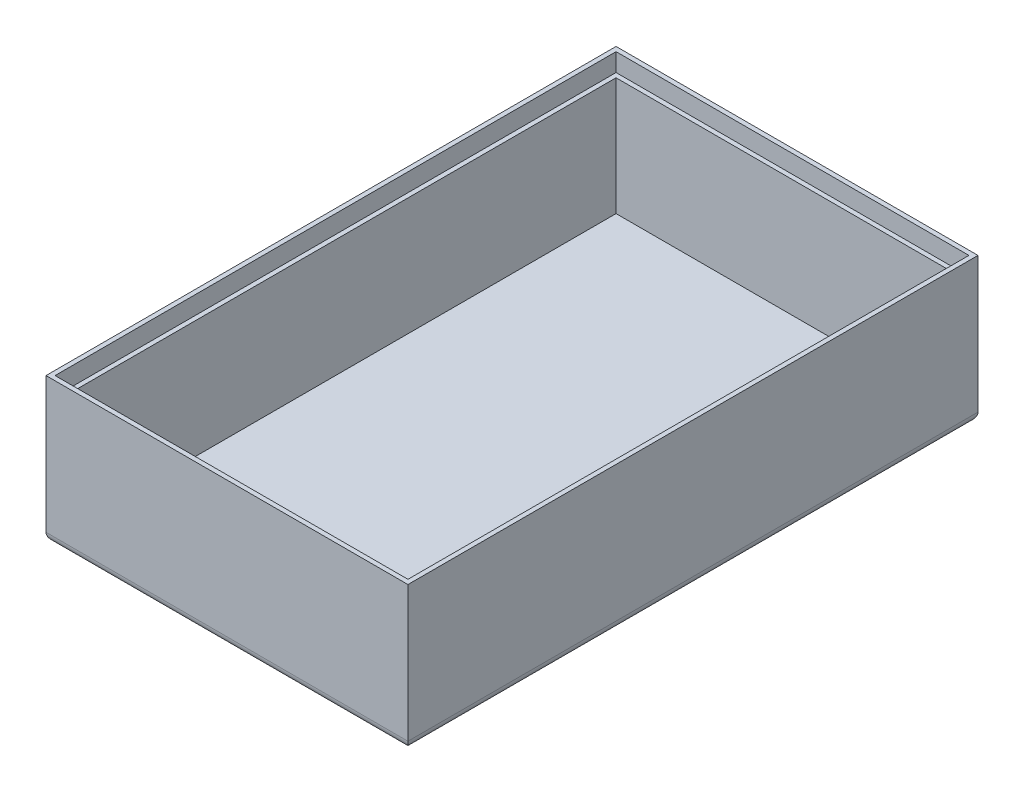
from build123d import *

# Parameters (mm, degrees)
SKETCH_1_W          = 40
SKETCH_1_H          = 63
EXTRUDE_1_DEPTH     = 16
SKETCH_2_W          = 38
SKETCH_2_H          = 61
CUT_EXTRUDE_2_DEPTH = 15
FILLET_2_R          = 1
SKETCH_5_W          = 38
SKETCH_5_H          = 2
CUT_EXTRUDE_4_DEPTH = 0.5
SKETCH_6_W          = 61.5
SKETCH_6_H          = 2
CUT_EXTRUDE_5_DEPTH = 0.5
SKETCH_7_W          = 38.5
SKETCH_7_H          = 2
CUT_EXTRUDE_6_DEPTH = 0.5
SKETCH_8_W          = 62
SKETCH_8_H          = 2
CUT_EXTRUDE_7_DEPTH = 0.5


with BuildPart() as part:
    # Эскиз1 → Бобышка-Вытянуть1 (new body)
    with BuildSketch(Plane(origin=(0, 0, 0), x_dir=(1, 0, 0), z_dir=(0, 1, 0))):
        with Locations((18.915, -30.961)):
            Rectangle(SKETCH_1_W, SKETCH_1_H)
    extrude(amount=EXTRUDE_1_DEPTH)

    # Эскиз2 → Вырез-Вытянуть2 (cut)
    with BuildSketch(Plane(origin=(0, 16, 0), x_dir=(1, 0, 0), z_dir=(0, 1, 0))):
        with Locations((18.915, -30.961)):
            Rectangle(SKETCH_2_W, SKETCH_2_H)
    extrude(amount=-CUT_EXTRUDE_2_DEPTH, mode=Mode.SUBTRACT)

    # Скругление2
    fillet_2_edges = [part.edges().sort_by_distance(p)[0] for p in [
        (18.915, 0, -0.539),
        (38.915, 0, 30.961),
        (18.915, 0, 62.461),
        (-1.085, 0, 30.961),
    ]]
    fillet(fillet_2_edges, radius=FILLET_2_R)

    # Эскиз5 → Вырез-Вытянуть4 (cut)
    with BuildSketch(Plane(origin=(0, 0, 61.461), x_dir=(-1, 0, 0), z_dir=(0, 0, -1))):
        with Locations((-18.915, 15)):
            Rectangle(SKETCH_5_W, SKETCH_5_H)
    extrude(amount=-CUT_EXTRUDE_4_DEPTH, mode=Mode.SUBTRACT)

    # Эскиз6 → Вырез-Вытянуть5 (cut)
    with BuildSketch(Plane(origin=(-0.085, 0, 0), x_dir=(0, 0, -1), z_dir=(1, 0, 0))):
        with Locations((-31.211, 15)):
            Rectangle(SKETCH_6_W, SKETCH_6_H)
    extrude(amount=-CUT_EXTRUDE_5_DEPTH, mode=Mode.SUBTRACT)

    # Эскиз7 → Вырез-Вытянуть6 (cut)
    with BuildSketch(Plane.XY.offset(0.461)):
        with Locations((18.665, 15)):
            Rectangle(SKETCH_7_W, SKETCH_7_H)
    extrude(amount=-CUT_EXTRUDE_6_DEPTH, mode=Mode.SUBTRACT)

    # Эскиз8 → Вырез-Вытянуть7 (cut)
    with BuildSketch(Plane.ZY.offset(-37.915)):
        with Locations((30.961, 15)):
            Rectangle(SKETCH_8_W, SKETCH_8_H)
    extrude(amount=-CUT_EXTRUDE_7_DEPTH, mode=Mode.SUBTRACT)


solid = part.part
